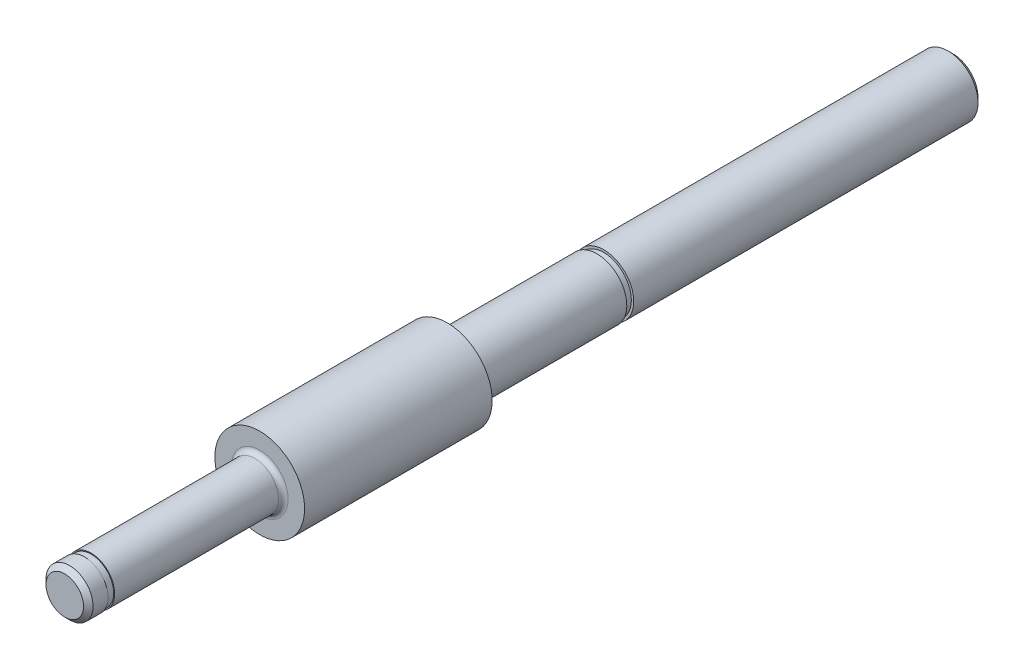
from build123d import *

# Parameters (mm, degrees)
CHAMFER1_SIZE = 0.508
FILLET1_R     = 0.508


with BuildPart() as part:
    # Sketch1 → Revolve1 (revolve)
    with BuildSketch(Plane(origin=(0, 0, 0), x_dir=(0, 0, -1), z_dir=(1, 0, 0))):
        Polygon((-71.766540521, 0), (-71.766540521, 1.992), (-71.258540521, 2.5), (-69.668678408, 2.5), (-69.668678408, 2.4), (-68.968678284, 2.4), (-68.968678284, 2.5), (-51.068678408, 2.5), (-51.068678408, 4.7625), (-31.157911357, 4.7625), (-31.157911357, 3.175), (-15.281908522, 3.175), (-15.281908522, 2.921), (-14.545308522, 2.921), (-14.545308522, 3.175), (22.508173379, 3.175), (22.508173379, 0), align=None)
    revolve(axis=Axis((0, 0, 0), (0, 0, 1)))

    # Chamfer1
    chamfer1_edges = [part.edges().sort_by_distance(p)[0] for p in [
        (0, -3.175, -22.508173379),
    ]]
    chamfer(chamfer1_edges, length=CHAMFER1_SIZE)

    # Fillet1
    fillet1_edges = [part.edges().sort_by_distance(p)[0] for p in [
        (0, -3.175, 31.157911357),
        (0, -2.5, 51.068678408),
    ]]
    fillet(fillet1_edges, radius=FILLET1_R)


solid = part.part
